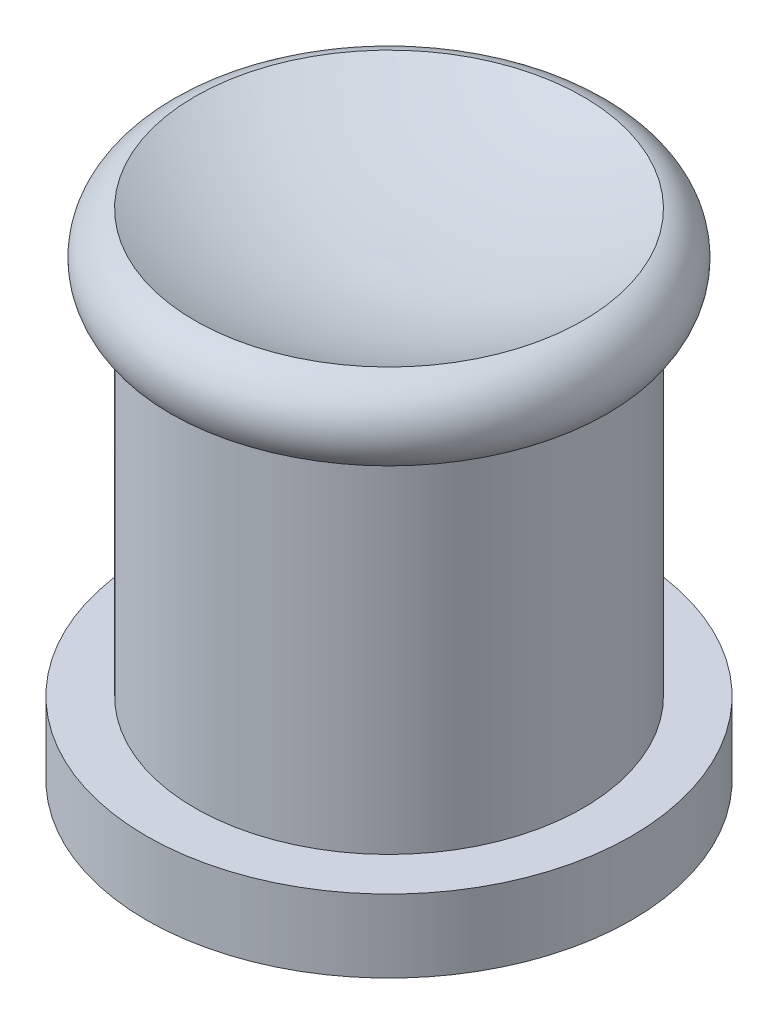
from build123d import *


with BuildPart() as part:
    # Sketch1 → Revolve1 (revolve)
    with BuildSketch(Plane.XY, mode=Mode.PRIVATE) as revolve1_sk:
        with BuildLine():
            Line((0, 0), (0, 0.85))
            Line((0, 0.85), (0, 0.93))
            ThreePointArc((0, 0.93), (0.205863515, 0.948939934), (0.4, 1.02))
            ThreePointArc((0.4, 1.02), (0.462747108, 0.962806691), (0.45, 0.878867513))
            Line((0.45, 0.878867513), (0.4, 0.85))
            Line((0.4, 0.85), (0.4, 0.15))
            Line((0.4, 0.15), (0.5, 0.15))
            Line((0.5, 0.15), (0.5, 0))
            Line((0.5, 0), (0, 0))
        make_face()
    revolve(revolve1_sk.sketch.rotate(Axis((0, 0.93, 0), (0, -1, 0)), 180), axis=Axis((0, 0.93, 0), (0, -1, 0)))


solid = part.part
